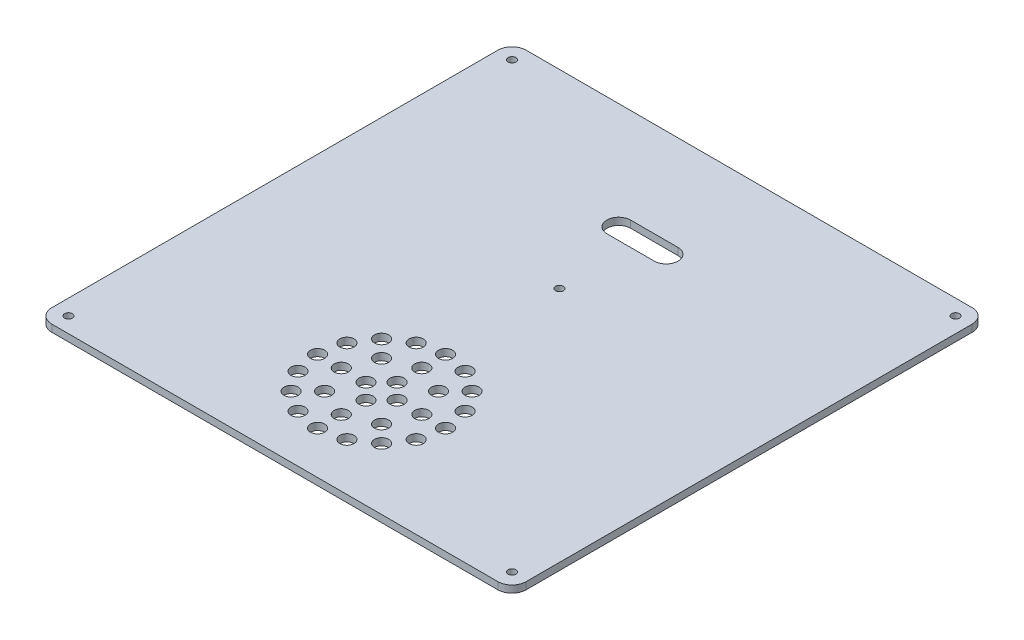
from build123d import *

# Parameters (mm, degrees)
SKETCH1_W           = 200
SKETCH1_H           = 200
SKETCH1_R           = 3
BOSS_EXTRUDE1_DEPTH = 3
FILLET1_R           = 6
FILLET2_R           = 6
FILLET3_R           = 6
FILLET4_R           = 6
SKETCH2_R           = 1.65
SKETCH2_R_2         = 5
CUT_EXTRUDE1_DEPTH  = 283.85862193


with BuildPart() as part:
    # Sketch1 → Boss-Extrude1 (new body)
    with BuildSketch(Plane(origin=(0, 0, 0), x_dir=(1, 0, 0), z_dir=(0, 1, 0))):
        with Locations((100, 100)):
            Rectangle(SKETCH1_W, SKETCH1_H)
        with Locations(Location((116.974857902, 45, 0), (0, 0, 270))):
            Circle(SKETCH1_R, mode=Mode.SUBTRACT)
        with Locations(Location((112.003037132, 32.996962868, 0), (0, 0, 270))):
            Circle(SKETCH1_R, mode=Mode.SUBTRACT)
        with Locations(Location((100, 28.025142098, 0), (0, 0, 270))):
            Circle(SKETCH1_R, mode=Mode.SUBTRACT)
        with Locations(Location((87.996962868, 32.996962868, 0), (0, 0, 270))):
            Circle(SKETCH1_R, mode=Mode.SUBTRACT)
        with Locations(Location((83.025142098, 45, 0), (0, 0, 270))):
            Circle(SKETCH1_R, mode=Mode.SUBTRACT)
        with Locations(Location((87.996962868, 57.003037132, 0), (0, 0, 270))):
            Circle(SKETCH1_R, mode=Mode.SUBTRACT)
        with Locations(Location((100, 61.974857902, 0), (0, 0, 270))):
            Circle(SKETCH1_R, mode=Mode.SUBTRACT)
        with Locations(Location((112.003037132, 57.003037132, 0), (0, 0, 270))):
            Circle(SKETCH1_R, mode=Mode.SUBTRACT)
        with Locations(Location((126.974857902, 45, 0), (0, 0, 270))):
            Circle(SKETCH1_R, mode=Mode.SUBTRACT)
        with Locations(Location((124.921888894, 34.679027829, 0), (0, 0, 270))):
            Circle(SKETCH1_R, mode=Mode.SUBTRACT)
        with Locations(Location((119.075527791, 25.929330111, 0), (0, 0, 270))):
            Circle(SKETCH1_R, mode=Mode.SUBTRACT)
        with Locations(Location((110.325830073, 20.082969008, 0), (0, 0, 270))):
            Circle(SKETCH1_R, mode=Mode.SUBTRACT)
        with Locations(Location((100.004857902, 18.03, 0), (0, 0, 270))):
            Circle(SKETCH1_R, mode=Mode.SUBTRACT)
        with Locations(Location((89.683885731, 20.082969008, 0), (0, 0, 270))):
            Circle(SKETCH1_R, mode=Mode.SUBTRACT)
        with Locations(Location((80.934188014, 25.929330111, 0), (0, 0, 270))):
            Circle(SKETCH1_R, mode=Mode.SUBTRACT)
        with Locations(Location((75.08782691, 34.679027829, 0), (0, 0, 270))):
            Circle(SKETCH1_R, mode=Mode.SUBTRACT)
        with Locations(Location((106.559618743, 45, 0), (0, 0, 270))):
            Circle(SKETCH1_R, mode=Mode.SUBTRACT)
        with Locations(Location((100, 38.440381257, 0), (0, 0, 270))):
            Circle(SKETCH1_R, mode=Mode.SUBTRACT)
        with Locations(Location((93.440381257, 45, 0), (0, 0, 270))):
            Circle(SKETCH1_R, mode=Mode.SUBTRACT)
        with Locations(Location((100, 51.559618743, 0), (0, 0, 270))):
            Circle(SKETCH1_R, mode=Mode.SUBTRACT)
        with Locations(Location((73.034857902, 45, 0), (0, 0, 270))):
            Circle(SKETCH1_R, mode=Mode.SUBTRACT)
        with Locations(Location((75.08782691, 55.320972171, 0), (0, 0, 270))):
            Circle(SKETCH1_R, mode=Mode.SUBTRACT)
        with Locations(Location((80.934188014, 64.070669889, 0), (0, 0, 270))):
            Circle(SKETCH1_R, mode=Mode.SUBTRACT)
        with Locations(Location((89.683885731, 69.917030992, 0), (0, 0, 270))):
            Circle(SKETCH1_R, mode=Mode.SUBTRACT)
        with Locations(Location((100.004857902, 71.97, 0), (0, 0, 270))):
            Circle(SKETCH1_R, mode=Mode.SUBTRACT)
        with Locations(Location((110.325830073, 69.917030992, 0), (0, 0, 270))):
            Circle(SKETCH1_R, mode=Mode.SUBTRACT)
        with Locations(Location((119.075527791, 64.070669889, 0), (0, 0, 270))):
            Circle(SKETCH1_R, mode=Mode.SUBTRACT)
        with Locations(Location((124.921888894, 55.320972171, 0), (0, 0, 270))):
            Circle(SKETCH1_R, mode=Mode.SUBTRACT)
    extrude(amount=BOSS_EXTRUDE1_DEPTH)

    # Fillet1
    fillet1_edges = [part.edges().sort_by_distance(p)[0] for p in [
        (0, 1.5, -200),
    ]]
    fillet(fillet1_edges, radius=FILLET1_R)

    # Fillet2
    fillet2_edges = [part.edges().sort_by_distance(p)[0] for p in [
        (200, 1.5, -200),
    ]]
    fillet(fillet2_edges, radius=FILLET2_R)

    # Fillet3
    fillet3_edges = [part.edges().sort_by_distance(p)[0] for p in [
        (200, 1.5, 0),
    ]]
    fillet(fillet3_edges, radius=FILLET3_R)

    # Fillet4
    fillet4_edges = [part.edges().sort_by_distance(p)[0] for p in [
        (0, 1.5, 0),
    ]]
    fillet(fillet4_edges, radius=FILLET4_R)

    # Sketch2 → Cut-Extrude1 (cut, through all)
    with BuildSketch(Plane(origin=(0, 3, 0), x_dir=(1, 0, 0), z_dir=(0, 1, 0))):
        with Locations(Location((6.5, 6.5, 0), (0, 0, 270))):
            Circle(SKETCH2_R)
        with Locations(Location((193.5, 6.5, 0), (0, 0, 270))):
            Circle(SKETCH2_R)
        with Locations(Location((193.5, 193.5, 0), (0, 0, 270))):
            Circle(SKETCH2_R)
        with Locations((90, 155)):
            Circle(SKETCH2_R_2)
        with BuildLine():
            ThreePointArc((110, 150), (105, 155), (110, 160))
            Line((110, 160), (90, 160))
            ThreePointArc((90, 160), (93.535533906, 158.535533906), (95, 155))
            ThreePointArc((95, 155), (93.535533906, 151.464466094), (90, 150))
            Line((90, 150), (110, 150))
        make_face()
        with Locations((110, 155)):
            Circle(SKETCH2_R_2)
        with Locations(Location((100, 120, 0), (0, 0, 270))):
            Circle(SKETCH2_R)
        with Locations(Location((6.5, 193.5, 0), (0, 0, 270))):
            Circle(SKETCH2_R)
    extrude(amount=-CUT_EXTRUDE1_DEPTH, mode=Mode.SUBTRACT)


solid = part.part
